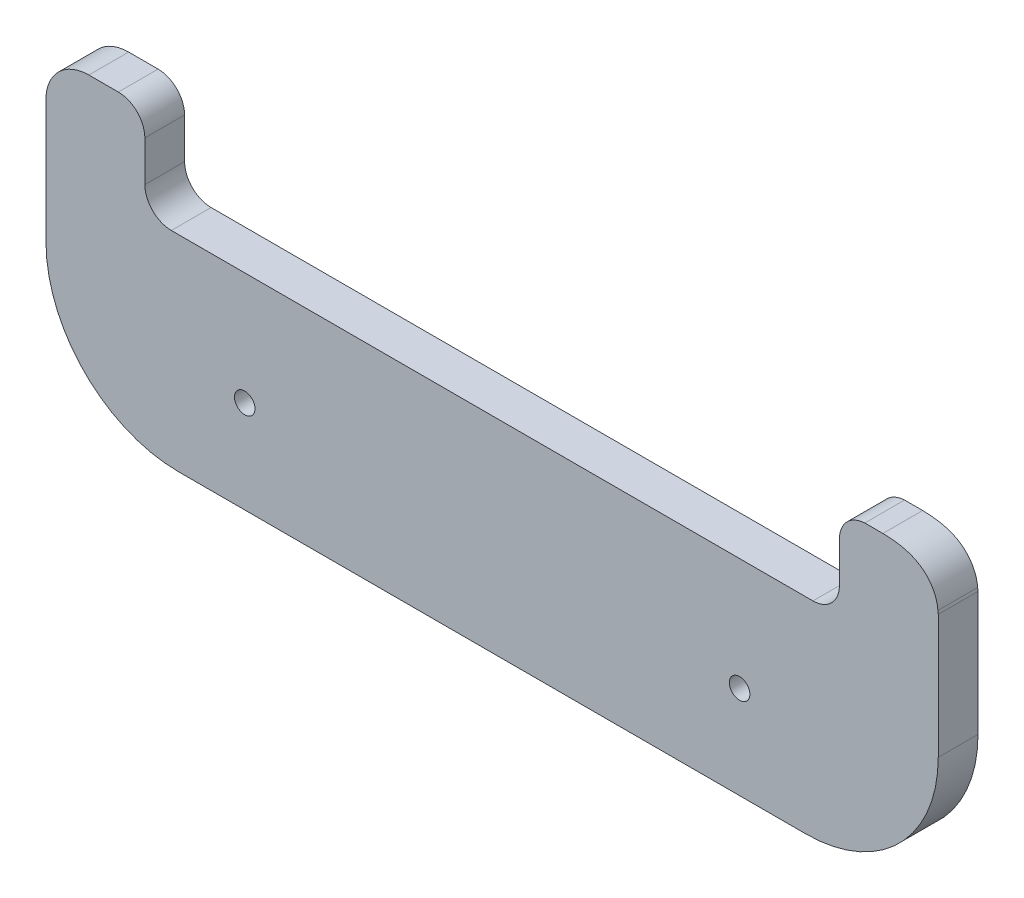
from build123d import *

# Parameters (mm, degrees)
DODANIE_WYCI_GNI_CIE1_DEPTH = 6
SZKIC5_R                    = 1.55
WYTNIJ_WYCI_GNI_CIE4_DEPTH  = 6
WYTNIJ_WYCI_GNI_CIE3_DEPTH  = 10
WYTNIJ_WYCI_GNI_CIE5_DEPTH  = 6


with BuildPart() as part:
    # Szkic1 → Dodanie-wyciągnięcie1 (new body)
    with BuildSketch(Plane.XY):
        with BuildLine():
            Line((559.30310538, -401.196233577), (679.169206808, -401.196233577))
            add(Edge.make_bspline(
                [(687.47449185, -407.105172623), (687.460895427, -406.945083018), (687.399523084, -406.440112421), (687.106391165, -405.247306424), (686.199030087, -403.66784482), (684.728358654, -402.453584158), (683.321816891, -401.804200876), (682.065878557, -401.467025134), (680.947934354, -401.299453727), (680.131685922, -401.236634896), (679.578376244, -401.210432629), (679.339173948, -401.201842063), (679.210839256, -401.19761192), (679.187499025, -401.196838314), (679.169206808, -401.196233577)],
                knots=[0.021401383, 0.021401383, 0.021401383, 0.021401383, 0.051544166, 0.115122874, 0.24228029, 0.369437707, 0.496595123, 0.62375254, 0.750909956, 0.878067373, 0.941646081, 0.990181611, 0.996198883, 1.005224789, 1.005224789, 1.005224789, 1.005224789], degree=3))
            Line((687.47449185, -407.105172623), (687.524116, -407.588097358))
            Line((687.524116, -407.588097358), (687.524116, -419.296173359))
            Line((687.524116, -419.296173359), (687.524116, -426.296170097))
            ThreePointArc((687.524116, -426.296170097), (681.666251932, -440.438306105), (667.524116585, -446.296171768))
            Line((667.524116585, -446.296171768), (572.829457094, -446.296179681))
            ThreePointArc((572.829457094, -446.296179681), (558.687321683, -440.438316102), (552.829456509, -426.296181352))
            Line((552.829456509, -426.296181352), (552.829456509, -407.696232795))
            Line((552.829456509, -407.696232795), (552.829456509, -407.111536822))
            ThreePointArc((552.829456509, -407.111536822), (554.918503283, -402.897768775), (559.30310538, -401.196233577))
        make_face()
    extrude(amount=DODANIE_WYCI_GNI_CIE1_DEPTH)

    # Szkic5 → Wytnij-wyciągnięcie4 (cut)
    with BuildSketch(Plane.XY.offset(6)):
        with Locations((582.829456509, -432.296173588)):
            Circle(SZKIC5_R)
        with Locations((657.534304884, -432.275447832)):
            Circle(SZKIC5_R)
    extrude(amount=-WYTNIJ_WYCI_GNI_CIE4_DEPTH, mode=Mode.SUBTRACT)

    # Szkic4 → Wytnij-wyciągnięcie3 (cut)
    with BuildSketch(Plane.XY.offset(6)):
        with BuildLine():
            Line((598.90310538, -405.068549386), (592.90310538, -405.068549386))
            ThreePointArc((592.90310538, -405.068549386), (590.428231646, -406.093675652), (589.40310538, -408.568549386))
            Line((589.40310538, -408.568549386), (589.40310538, -409.168549386))
            ThreePointArc((589.40310538, -409.168549386), (590.428231646, -411.64342312), (592.90310538, -412.668549386))
            Line((592.90310538, -412.668549386), (598.90310538, -412.668549386))
            ThreePointArc((598.90310538, -412.668549386), (601.377979114, -411.64342312), (602.40310538, -409.168549386))
            Line((602.40310538, -409.168549386), (602.40310538, -408.568549386))
            ThreePointArc((602.40310538, -408.568549386), (601.377979114, -406.093675652), (598.90310538, -405.068549386))
        make_face()
    extrude(amount=-WYTNIJ_WYCI_GNI_CIE3_DEPTH, mode=Mode.SUBTRACT)

    # Szkic7 → Wytnij-wyciągnięcie5 (cut)
    with BuildSketch(Plane.XY.offset(6)):
        with BuildLine():
            Line((668.604116, -415.296173181), (571.751345179, -415.296173181))
            ThreePointArc((571.751345179, -415.296173181), (568.922918055, -414.124600305), (567.751345179, -411.296173181))
            Line((567.751345179, -411.296173181), (567.751345179, -405.196233577))
            ThreePointArc((567.751345179, -405.196233577), (566.579772304, -402.367806452), (563.751345179, -401.196233577))
            Line((563.751345179, -401.196233577), (676.593615823, -401.192611842))
            ThreePointArc((676.593615823, -401.192611842), (673.771978935, -402.367885748), (672.604116, -405.19259806))
            Line((672.604116, -405.19259806), (672.604116, -411.296173181))
            ThreePointArc((672.604116, -411.296173181), (671.432543125, -414.124600305), (668.604116, -415.296173181))
        make_face()
    extrude(amount=-WYTNIJ_WYCI_GNI_CIE5_DEPTH, mode=Mode.SUBTRACT)


solid = part.part
